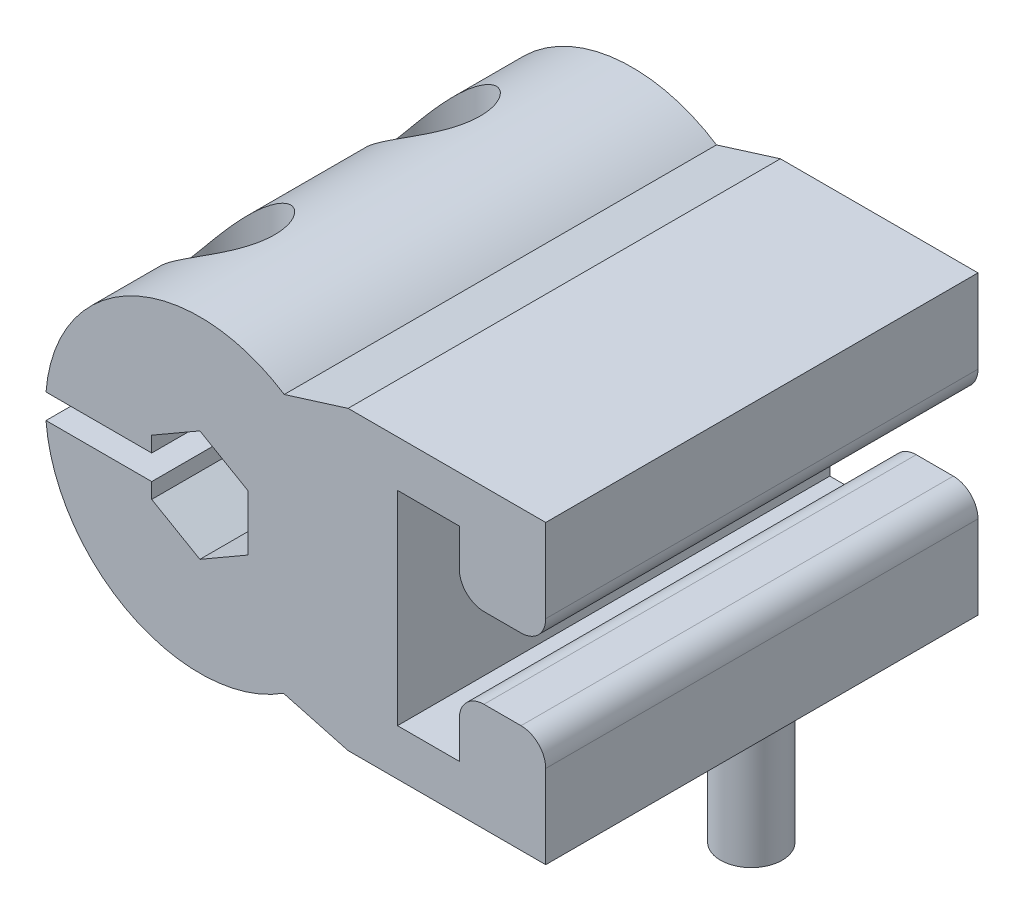
from build123d import *

# Parameters (mm, degrees)
BOSS_EXTRUDE1_DEPTH = 35
SKETCH2_R           = 1.8669
CUT_EXTRUDE1_DEPTH  = 45.791182168
SKETCH3_R           = 3.9497
CUT_EXTRUDE2_DEPTH  = 8
CUT_EXTRUDE3_DEPTH  = 8
BOSS_EXTRUDE2_DEPTH = 35
FILLET1_R           = 2
SKETCH6_R           = 2.5
BOSS_EXTRUDE3_DEPTH = 13
FILLET2_R           = 2


with BuildPart() as part:
    # Sketch1 → Boss-Extrude1 (new body)
    with BuildSketch(Plane.XY):
        with BuildLine():
            ThreePointArc((12.5, 0), (0.500401124, 12.489979933), (-12.459935794, 1))
            Line((-12.459935794, 1), (-3.9, 1))
            Line((-3.9, 1), (-3.9, 2.25166605))
            Line((-3.9, 2.25166605), (0, 4.5033321))
            Line((0, 4.5033321), (3.9, 2.25166605))
            Line((3.9, 2.25166605), (3.9, -2.25166605))
            Line((3.9, -2.25166605), (0, -4.5033321))
            Line((0, -4.5033321), (-3.9, -2.25166605))
            Line((-3.9, -2.25166605), (-3.9, -1))
            Line((-3.9, -1), (-12.459935794, -1))
            ThreePointArc((-12.459935794, -1), (0.500401124, -12.489979933), (12.5, 0))
        make_face()
    extrude(amount=BOSS_EXTRUDE1_DEPTH)

    # Sketch2 → Cut-Extrude1 (cut, through all)
    with BuildSketch(Plane(origin=(0, 12.5, 0), x_dir=(1, 0, 0), z_dir=(0, 1, 0))):
        with Locations(Location((-7.078786681, -9.175485886, 0), (0, 0, 270))):
            Circle(SKETCH2_R)
        with Locations(Location((-7.078786681, -25.824514114, 0), (0, 0, 270))):
            Circle(SKETCH2_R)
    extrude(amount=-CUT_EXTRUDE1_DEPTH, mode=Mode.SUBTRACT)

    # Sketch3 → Cut-Extrude2 (cut)
    with BuildSketch(Plane(origin=(0, 12.5, 0), x_dir=(1, 0, 0), z_dir=(0, 1, 0))):
        with Locations(Location((-7.078786681, -9.175485886, 0), (0, 0, 270))):
            Circle(SKETCH3_R)
        with Locations(Location((-7.078786681, -25.824514114, 0), (0, 0, 270))):
            Circle(SKETCH3_R)
    extrude(amount=-CUT_EXTRUDE2_DEPTH, mode=Mode.SUBTRACT)

    # Sketch4 → Cut-Extrude3 (cut)
    with BuildSketch(Plane(origin=(0, -12.5, 0), x_dir=(-1, 0, 0), z_dir=(0, -1, 0))):
        Polygon((7.078786681, -5.230682437), (3.662486681, -7.203084162), (3.662486681, -11.147887611), (7.078786681, -13.120289335), (10.495086681, -11.147887611), (10.495086681, -7.203084162), align=None)
        Polygon((7.078786681, -21.879710665), (3.662486681, -23.852112389), (3.662486681, -27.796915838), (7.078786681, -29.769317563), (10.495086681, -27.796915838), (10.495086681, -23.852112389), align=None)
    extrude(amount=-CUT_EXTRUDE3_DEPTH, mode=Mode.SUBTRACT)

    # Sketch5 → Boss-Extrude2 (add, through all)
    with BuildSketch(Plane(origin=(0, 0, 0), x_dir=(-1, 0, 0), z_dir=(0, 0, -1))):
        with BuildLine():
            Line((-12, 12.083333333), (-6.827937157, 10.470399905))
            ThreePointArc((-6.827937157, 10.470399905), (-12.499949552, -0.035513444), (-6.768332777, -10.509028091))
            Line((-6.768332777, -10.509028091), (-12, -11.916666667))
            Line((-12, -11.916666667), (-28, -11.916666667))
            Line((-28, -11.916666667), (-28, -3.166666667))
            Line((-28, -3.166666667), (-21, -3.166666667))
            Line((-21, -3.166666667), (-21, -8.166666667))
            Line((-21, -8.166666667), (-16, -8.166666667))
            Line((-16, -8.166666667), (-16, 8.333333333))
            Line((-16, 8.333333333), (-21, 8.333333333))
            Line((-21, 8.333333333), (-21, 3.333333333))
            Line((-21, 3.333333333), (-28, 3.333333333))
            Line((-28, 3.333333333), (-28, 12.083333333))
            Line((-28, 12.083333333), (-12, 12.083333333))
        make_face()
    extrude(amount=-BOSS_EXTRUDE2_DEPTH)

    # Fillet1
    fillet1_edges = [part.edges().sort_by_distance(p)[0] for p in [
        (28, -3.166666667, 17.5),
        (21, -3.166666667, 17.5),
        (21, 3.333333333, 17.5),
        (28, 3.333333333, 17.5),
    ]]
    fillet(fillet1_edges, radius=FILLET1_R)

    # Sketch6 → Boss-Extrude3 (add)
    with BuildSketch(Plane.XZ.offset(11.916666667)):
        with Locations(Location((21.762676708, 12.114369006, 0), (0, 0, 90))):
            Circle(SKETCH6_R)
    extrude(amount=BOSS_EXTRUDE3_DEPTH)

    # Fillet2
    fillet2_edges = [part.edges().sort_by_distance(p)[0] for p in [
        (21.762676708, -11.916666667, 9.614369006),
    ]]
    fillet(fillet2_edges, radius=FILLET2_R)


solid = part.part
